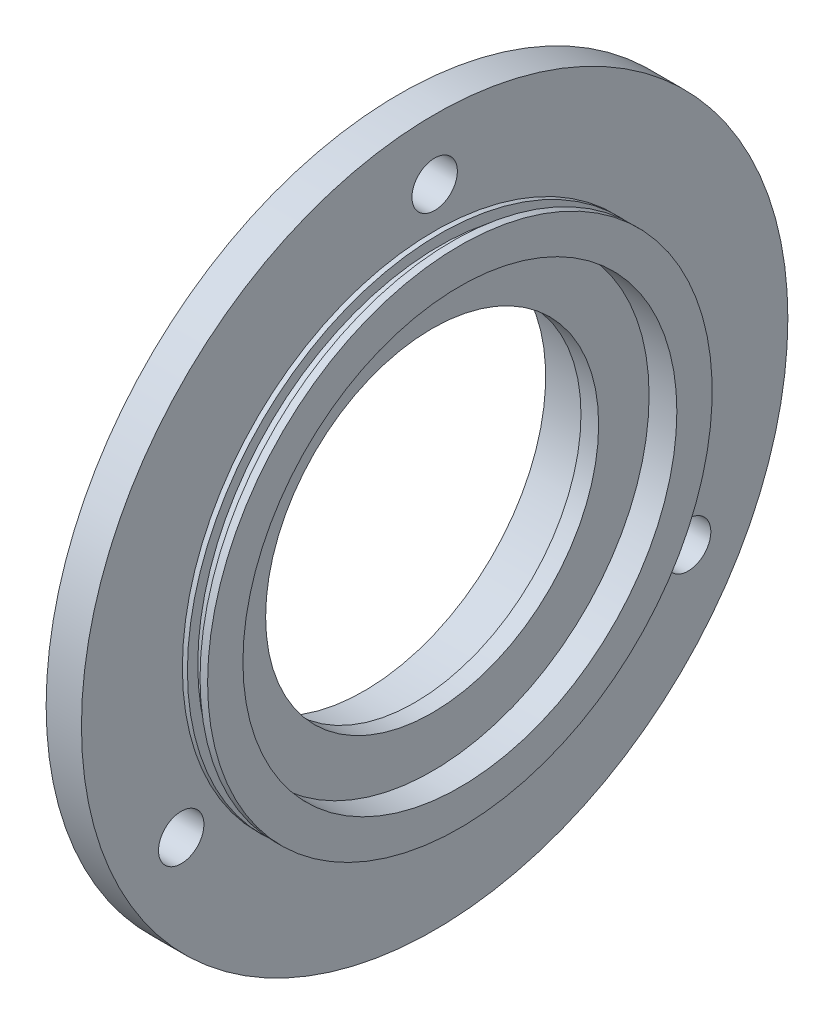
from build123d import *

# Parameters (mm, degrees)
SCHIZZO2_R               = 4.5
TAGLIO_ESTRUSIONE2_DEPTH = 57


with BuildPart() as part:
    # Schizzo1 → Rivoluzione1 (revolve)
    with BuildSketch(Plane.XY, mode=Mode.PRIVATE) as rivoluzione1_sk:
        Polygon((0, 43), (0, 50), (-1.5, 50), (-1.5, 47.95), (-4, 47.95), (-4, 50), (-5, 50), (-5, 70), (-12, 70), (-12, 39), (-19, 39), (-19, 36), (-9, 36), (-9, 33), (-5.5, 33), (-5.5, 43), align=None)
    revolve(rivoluzione1_sk.sketch.rotate(Axis((-54.554939241, 0, 0), (1, 0, 0)), 90), axis=Axis((-54.554939241, 0, 0), (1, 0, 0)))

    # Schizzo2 → Taglio-Estrusione2 (cut)
    with BuildSketch(Plane.ZY.offset(12)):
        with Locations((0, 58)):
            Circle(SCHIZZO2_R)
        with Locations((50.22947342, -29)):
            Circle(SCHIZZO2_R)
        with Locations((-50.229473419, -29)):
            Circle(SCHIZZO2_R)
    extrude(amount=-TAGLIO_ESTRUSIONE2_DEPTH, mode=Mode.SUBTRACT)


solid = part.part
